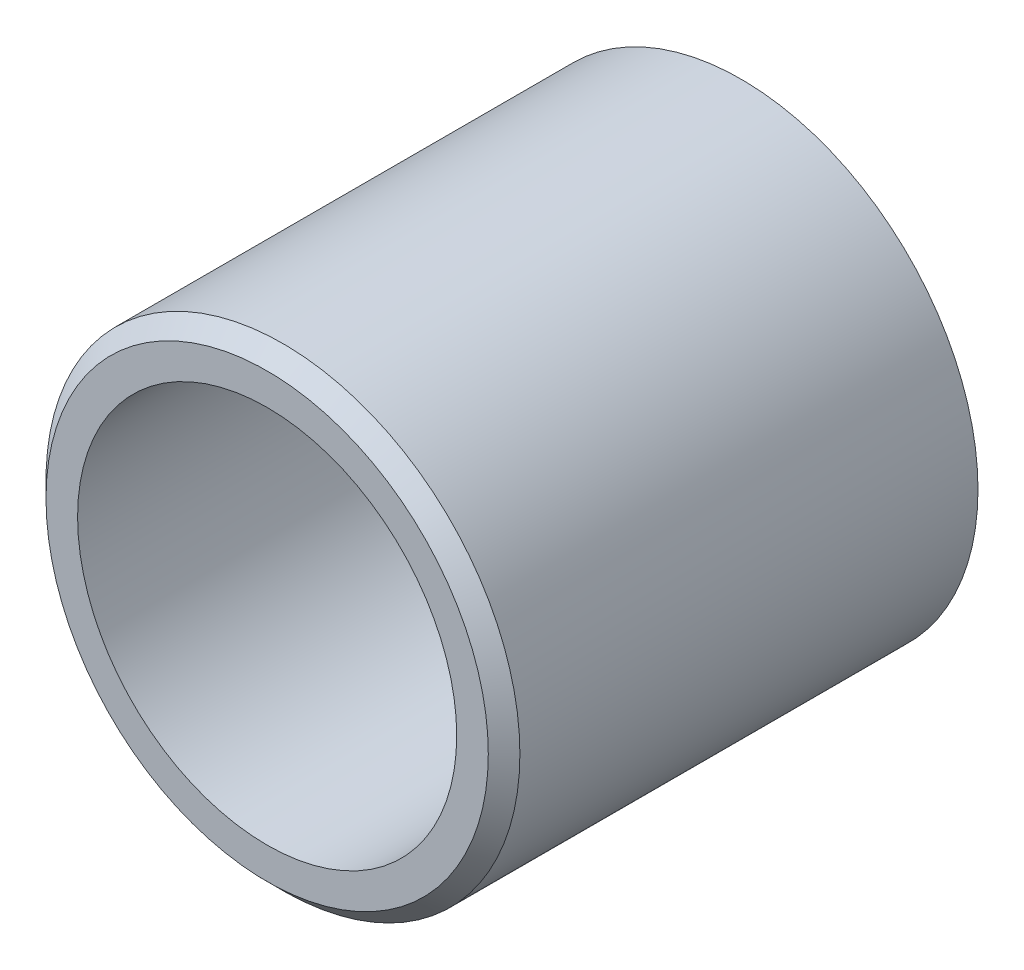
from build123d import *

# Parameters (mm, degrees)
SKETCH1_R           = 7.5
SKETCH1_R_2         = 6
BOSS_EXTRUDE1_DEPTH = 15
CHAMFER1_SIZE       = 0.5
SCALE1_SCALE        = 0.317565217


with BuildPart() as part:
    # Sketch1 → Boss-Extrude1 (new body)
    with BuildSketch(Plane.XY):
        Circle(SKETCH1_R)
        Circle(SKETCH1_R_2, mode=Mode.SUBTRACT)
    extrude(amount=BOSS_EXTRUDE1_DEPTH)

    # Chamfer1
    chamfer1_edges = [part.edges().sort_by_distance(p)[0] for p in [
        (-7.5, 0, 15),
    ]]
    chamfer(chamfer1_edges, length=CHAMFER1_SIZE)


with BuildPart() as part_1:
    # Scale1: scaled about (0, 0, 7.455475435)
    add(part.part.scale(SCALE1_SCALE).moved(Location((0, 0, 5.087875758))))


solid = part_1.part
